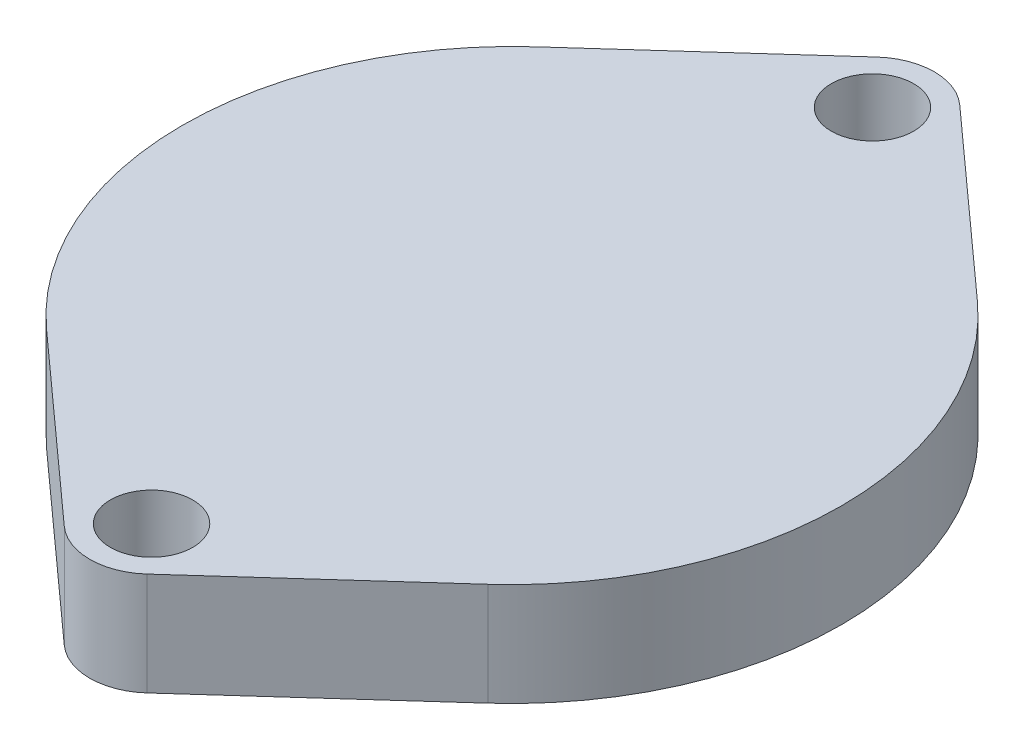
from build123d import *

# Parameters (mm, degrees)
SKETCH_1_R      = 2
EXTRUDE_1_DEPTH = 5


with BuildPart() as part:
    # 草图1 → 凸台-拉伸1 (new body)
    with BuildSketch(Plane(origin=(0, 0, 0), x_dir=(1, 0, 0), z_dir=(0, 1, 0))):
        with BuildLine():
            ThreePointArc((2.008349917, -19.728571429), (0, -20.5), (-2.008349917, -19.728571429))
            Line((-2.008349917, -19.728571429), (-10.711199556, -11.885714286))
            ThreePointArc((-10.711199556, -11.885714286), (-16, 0), (-10.711199556, 11.885714286))
            Line((-10.711199556, 11.885714286), (-2.008349917, 19.728571429))
            ThreePointArc((-2.008349917, 19.728571429), (0, 20.5), (2.008349917, 19.728571429))
            Line((2.008349917, 19.728571429), (10.711199556, 11.885714286))
            ThreePointArc((10.711199556, 11.885714286), (16, 0), (10.711199556, -11.885714286))
            Line((10.711199556, -11.885714286), (2.008349917, -19.728571429))
        make_face()
        with Locations(Location((0, 17.5, 0), (0, 0, 270))):
            Circle(SKETCH_1_R, mode=Mode.SUBTRACT)
        with Locations(Location((0, -17.5, 0), (0, 0, 270))):
            Circle(SKETCH_1_R, mode=Mode.SUBTRACT)
    extrude(amount=EXTRUDE_1_DEPTH)


solid = part.part
